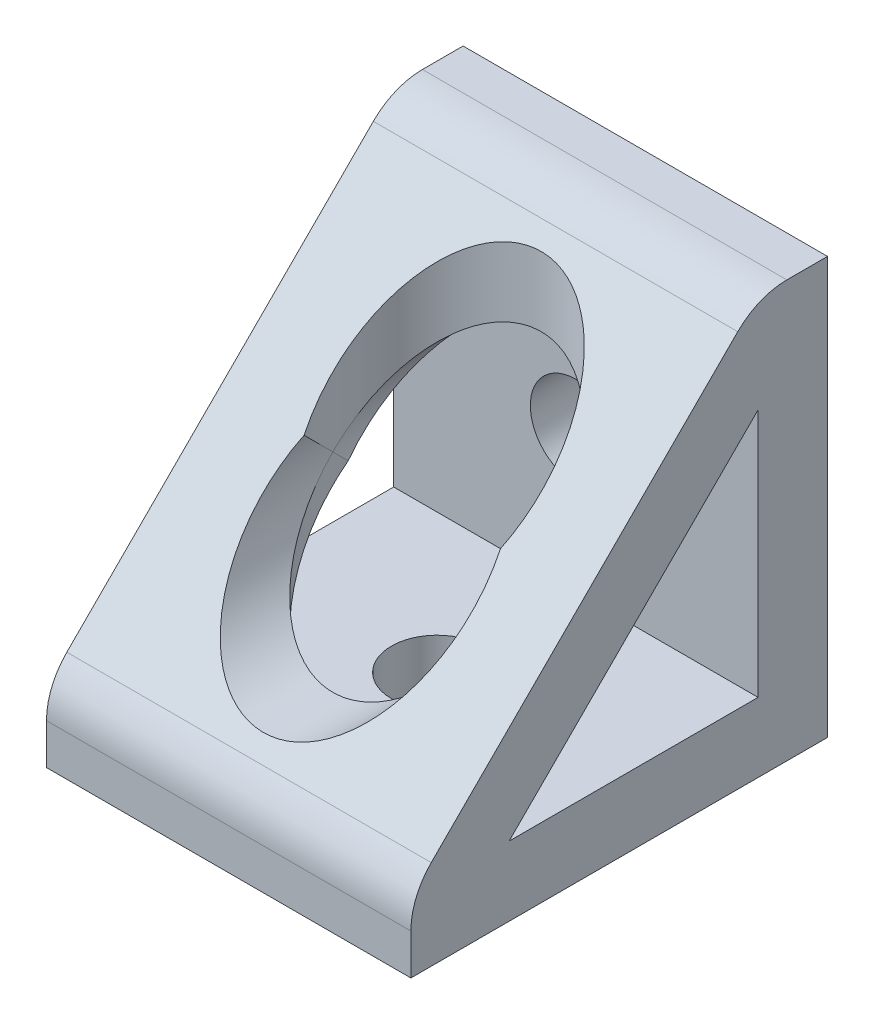
from build123d import *

# Parameters (mm, degrees)
BOSS_EXTRUDE1_DEPTH = 16.6624
CUT_EXTRUDE1_REACH  = 42.603
SKETCH5_R           = 4.1656
CUT_EXTRUDE2_REACH  = 42.603
SKETCH6_R           = 4.1656
CUT_EXTRUDE9_REACH  = 47.74
SKETCH27_R          = 9.525
CUT_EXTRUDE10_REACH = 47.74
SKETCH28_R          = 9.525


with BuildPart() as part:
    # Sketch4 → Boss-Extrude1 (new, symmetric)
    with BuildSketch(Plane(origin=(0, 0, 0), x_dir=(0, 0, -1), z_dir=(1, 0, 0))):
        with BuildLine():
            Line((-19.05, -19.05), (19.05, -19.05))
            Line((19.05, -19.05), (19.05, 19.05))
            Line((19.05, 19.05), (15.330256, 19.05))
            ThreePointArc((15.330256, 19.05), (12.900216, 18.566635), (10.840128, 17.190128))
            Line((10.840128, 17.190128), (-17.190128, -10.840128))
            ThreePointArc((-17.190128, -10.840128), (-18.566635, -12.900216), (-19.05, -15.330256))
            Line((-19.05, -15.330256), (-19.05, -19.05))
        make_face()
        Polygon((-10.069744, -12.7), (12.7, -12.7), (12.7, 10.069744), align=None, mode=Mode.SUBTRACT)
    extrude(amount=BOSS_EXTRUDE1_DEPTH, both=True)

    # Sketch5 → Cut-Extrude1 (cut, up to next)
    with BuildSketch(Plane(origin=(0, -12.7, 0), x_dir=(1, 0, 0), z_dir=(0, 1, 0)), mode=Mode.PRIVATE) as cut_extrude1_sk1:
        with Locations(Location((0, 0, 0), (0, 0, 270))):
            Circle(SKETCH5_R)
    cut_extrude1_tool1 = extrude(cut_extrude1_sk1.sketch, amount=-CUT_EXTRUDE1_REACH, mode=Mode.PRIVATE) & part.part
    add(cut_extrude1_tool1.solids().sort_by_distance((0, -12.7, 0))[0], mode=Mode.SUBTRACT)

    # Sketch6 → Cut-Extrude2 (cut, up to next)
    with BuildSketch(Plane.XY.offset(-12.7), mode=Mode.PRIVATE) as cut_extrude2_sk1:
        Circle(SKETCH6_R)
    cut_extrude2_tool1 = extrude(cut_extrude2_sk1.sketch, amount=-CUT_EXTRUDE2_REACH, mode=Mode.PRIVATE) & part.part
    add(cut_extrude2_tool1.solids().sort_by_distance((0, 0, -12.7))[0], mode=Mode.SUBTRACT)

    # Cut-Extrude9: up to this plane
    cut_extrude9_end = Plane(origin=(16.6624, -12.7, 10.069744), z_dir=(0, -0.7071067811865474, -0.7071067811865477))
    # Sketch27 → Cut-Extrude9 (cut, up to the surface)
    with BuildSketch(Plane.XY.offset(19.05), mode=Mode.PRIVATE) as cut_extrude9_sk1:
        with Locations(Location((0, 0, 0), (0, 0, 270))):
            Circle(SKETCH27_R)
    cut_extrude9_tool1 = split(extrude(cut_extrude9_sk1.sketch, amount=-CUT_EXTRUDE9_REACH, mode=Mode.PRIVATE), bisect_by=cut_extrude9_end, keep=Keep.BOTH, mode=Mode.PRIVATE)
    add(cut_extrude9_tool1.solids().sort_by_distance((0, 0, 19.05))[0], mode=Mode.SUBTRACT)

    # Cut-Extrude10: up to this face of the body (flat: up to its plane)
    cut_extrude10_end = Plane(part.part.faces().sort_by_distance((-16.258791, -12.7, -1.315128))[0])
    # Sketch28 → Cut-Extrude10 (cut, up to the picked face)
    with BuildSketch(Plane(origin=(0, 19.05, 0), x_dir=(1, 0, 0), z_dir=(0, 1, 0)), mode=Mode.PRIVATE) as cut_extrude10_sk1:
        Circle(SKETCH28_R)
    cut_extrude10_tool1 = split(extrude(cut_extrude10_sk1.sketch, amount=-CUT_EXTRUDE10_REACH, mode=Mode.PRIVATE), bisect_by=cut_extrude10_end, keep=Keep.BOTH, mode=Mode.PRIVATE)
    add(cut_extrude10_tool1.solids().sort_by(Axis((0, 19.05, 0), (0, -1, 0)))[0], mode=Mode.SUBTRACT)


solid = part.part
